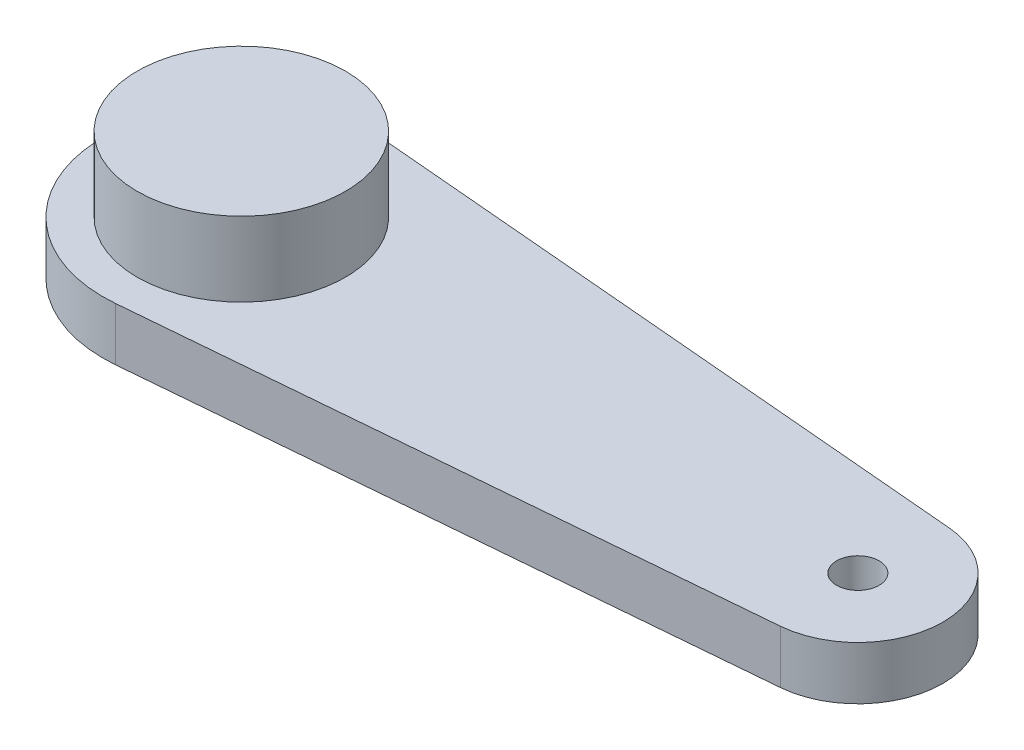
from build123d import *

# Parameters (mm, degrees)
SKETCH1_R           = 1
BOSS_EXTRUDE1_DEPTH = 2.5
SKETCH2_R           = 4.9
BOSS_EXTRUDE2_DEPTH = 3.5


with BuildPart() as part:
    # Sketch1 → Boss-Extrude1 (new body)
    with BuildSketch(Plane(origin=(0, 0, 0), x_dir=(1, 0, 0), z_dir=(0, 1, 0))):
        with BuildLine():
            Line((0.560344828, 6.475802165), (29.344827586, 3.985109024))
            ThreePointArc((29.344827586, 3.985109024), (33, 0), (29.344827586, -3.985109024))
            Line((29.344827586, -3.985109024), (0.560344828, -6.475802165))
            ThreePointArc((0.560344828, -6.475802165), (-6.5, 0), (0.560344828, 6.475802165))
        make_face()
        with Locations(Location((29, 0, 0), (0, 0, 270))):
            Circle(SKETCH1_R, mode=Mode.SUBTRACT)
    extrude(amount=BOSS_EXTRUDE1_DEPTH)

    # Sketch2 → Boss-Extrude2 (add)
    with BuildSketch(Plane(origin=(0, 2.5, 0), x_dir=(1, 0, 0), z_dir=(0, 1, 0))):
        with Locations(Location((0, 0, 0), (0, 0, 270))):
            Circle(SKETCH2_R)
    extrude(amount=BOSS_EXTRUDE2_DEPTH)


solid = part.part
